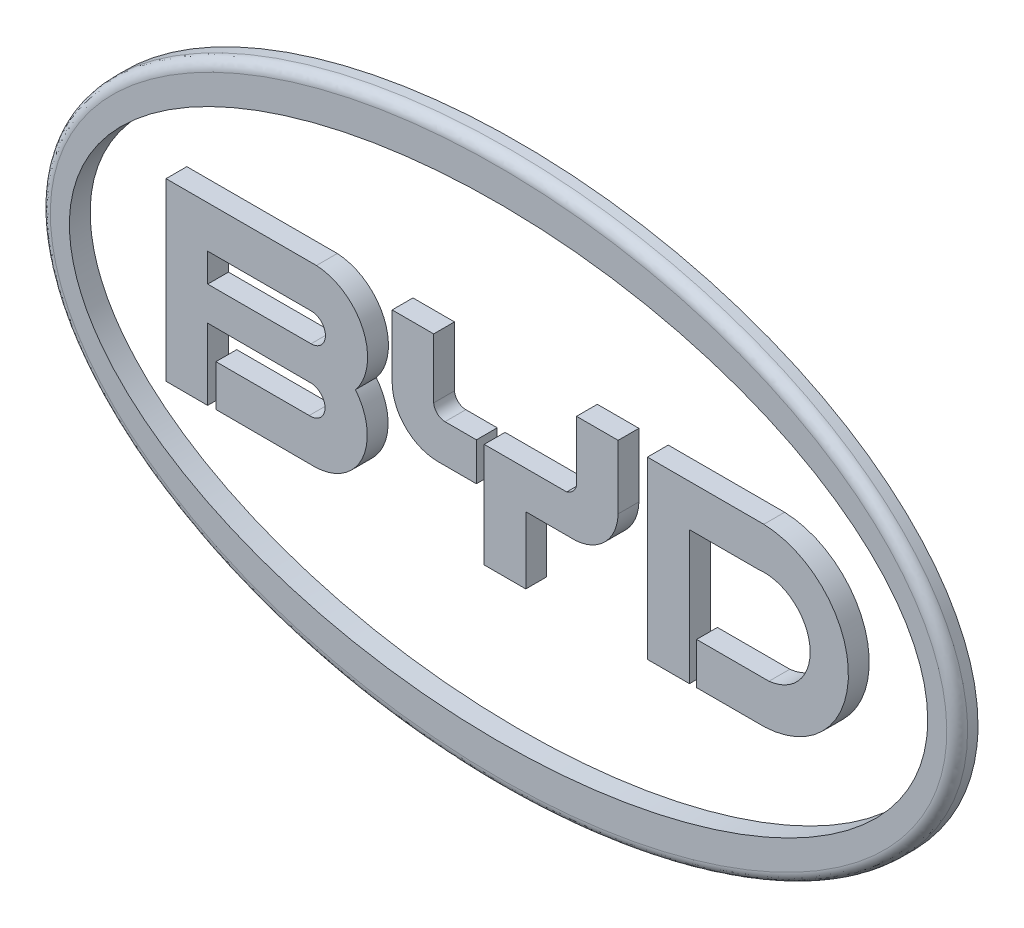
from build123d import *

# Parameters (mm, degrees)
SKETCH_3_RX       = 44.090053558
SKETCH_3_RY       = 26.443239621
SKETCH_3_RX_2     = 41.255952368
SKETCH_3_RY_2     = 22.400810242
EXTRUDE_1_DEPTH   = 2
EXTRUDE_1_2_DEPTH = 2
EXTRUDE_1_3_DEPTH = 2
EXTRUDE_1_4_DEPTH = 2
EXTRUDE_1_5_DEPTH = 2
FILLET_1_R        = 1


with BuildPart() as part:
    # 草图3 → 凸台-拉伸1 (new body)
    with BuildSketch(Plane.XY):
        with Locations(Location((117.824832916, 115.23790741), (0, 0, 180))):
            Ellipse(SKETCH_3_RX, SKETCH_3_RY)
        with Locations((117.824832916, 115.23790741)):
            Ellipse(SKETCH_3_RX_2, SKETCH_3_RY_2, mode=Mode.SUBTRACT)
    extrude(amount=EXTRUDE_1_DEPTH)

    # 圆角1
    fillet_1_edges = [part.edges().sort_by_distance(p)[0] for p in [
        (161.914770663, 115.298516103, 2),
    ]]
    fillet(fillet_1_edges, radius=FILLET_1_R)


with BuildPart() as body_2:
    # 草图3 → Extrude 1 2 (new body)
    with BuildSketch(Plane.XY):
        with BuildLine():
            Line((100.320487976, 123.701698303), (85.857902527, 123.701698303))
            Line((85.857902527, 123.701698303), (85.857902527, 106.831474304))
            Line((85.857902527, 106.831474304), (89.85785675, 106.821266174))
            Line((89.85785675, 106.821266174), (89.85785675, 113.6771698))
            Line((89.85785675, 113.6771698), (99.629045068, 113.652244725))
            ThreePointArc((99.629045068, 113.652244725), (99.745733087, 113.656821169), (99.86239624, 113.651649475))
            ThreePointArc((99.86239624, 113.651649475), (101.141097708, 112.257892609), (99.86239624, 110.864135742))
            ThreePointArc((99.86239624, 110.864135742), (99.742164596, 110.858959497), (99.621932952, 110.864135742))
            Line((99.621932952, 110.864135742), (90.656356812, 110.864135742))
            Line((90.656356812, 110.864135742), (90.656356812, 106.879867554))
            Line((90.656356812, 106.879867554), (99.860228116, 106.856387052))
            Line((99.860228116, 106.856387052), (100.208221436, 106.855499268))
            ThreePointArc((100.208221436, 106.855499268), (104.731739573, 109.852213429), (104.070821683, 115.23790741))
            ThreePointArc((104.070821683, 115.23790741), (104.793856796, 120.621074732), (100.320487976, 123.701698303))
        make_face()
        with BuildLine():
            Line((89.865707397, 116.923698425), (89.865707397, 119.666885376))
            Line((89.865707397, 119.666885376), (99.797425153, 119.666885376))
            Line((99.797425153, 119.666885376), (99.823417664, 119.666885376))
            ThreePointArc((99.823417664, 119.666885376), (101.182014946, 118.28271099), (99.798248291, 116.923698425))
            Line((99.798248291, 116.923698425), (89.865707397, 116.923698425))
        make_face(mode=Mode.SUBTRACT)
    extrude(amount=EXTRUDE_1_2_DEPTH)


with BuildPart() as body_3:
    # 草图3 → Extrude 1 3 (new body)
    with BuildSketch(Plane.XY):
        with BuildLine():
            ThreePointArc((111.588310242, 117.898681641), (111.937267918, 117.178522683), (112.678985596, 116.878097534))
            Line((112.678985596, 116.878097534), (115.696937561, 116.878097534))
            Line((115.696937561, 116.878097534), (115.696937561, 113.216255188))
            Line((115.696937561, 113.216255188), (112.02633667, 113.216255188))
            ThreePointArc((112.02633667, 113.216255188), (108.882327189, 114.5074245), (107.595947266, 117.653396606))
            Line((107.595947266, 117.653396606), (107.595947266, 123.64239502))
            Line((107.595947266, 123.64239502), (111.588310242, 123.64239502))
            Line((111.588310242, 123.64239502), (111.588310242, 117.898681641))
        make_face()
    extrude(amount=EXTRUDE_1_3_DEPTH)


with BuildPart() as body_4:
    # 草图3 → Extrude 1 4 (new body)
    with BuildSketch(Plane.XY):
        with BuildLine():
            Line((124.547664698, 113.264060974), (125.282608032, 113.264060974))
            ThreePointArc((125.282608032, 113.264060974), (128.113315049, 114.623573913), (129.320327759, 117.522590637))
            Line((129.320327759, 117.522590637), (129.320327759, 123.64755249))
            Line((129.320327759, 123.64755249), (125.319236755, 123.64755249))
            Line((125.319236755, 123.64755249), (125.319236755, 117.847755432))
            ThreePointArc((125.319236755, 117.847755432), (124.968269871, 117.246162802), (124.376983643, 116.878097534))
            Line((124.376983643, 116.878097534), (116.446258545, 116.873641968))
            Line((116.446258545, 116.873641968), (116.446258545, 106.834098816))
            Line((116.446258545, 106.834098816), (120.443962097, 106.834098816))
            Line((120.443962097, 106.834098816), (120.443962097, 113.264060974))
            Line((120.443962097, 113.264060974), (124.547664698, 113.264060974))
        make_face()
    extrude(amount=EXTRUDE_1_4_DEPTH)


with BuildPart() as body_5:
    # 草图3 → Extrude 1 5 (new body)
    with BuildSketch(Plane.XY):
        with BuildLine():
            ThreePointArc((143.89906311, 119.63936615), (147.779438013, 115.207061658), (143.822433472, 110.843032837))
            Line((143.822433472, 110.843032837), (136.862030029, 110.843032837))
            Line((136.862030029, 110.843032837), (136.862030029, 106.825332642))
            Line((136.862030029, 106.825332642), (143.409423828, 106.825332642))
            ThreePointArc((143.409423828, 106.825332642), (151.457049674, 115.283053778), (143.326080322, 123.660682678))
            Line((143.326080322, 123.660682678), (132.137237549, 123.660682678))
            Line((132.137237549, 123.660682678), (132.137237549, 106.814918518))
            Line((132.137237549, 106.814918518), (136.179397583, 106.814918518))
            Line((136.179397583, 106.814918518), (136.179397583, 119.63936615))
            Line((136.179397583, 119.63936615), (142.804812511, 119.63936615))
            ThreePointArc((142.804812511, 119.63936615), (143.351937811, 119.673300221), (143.89906311, 119.63936615))
        make_face()
    extrude(amount=EXTRUDE_1_5_DEPTH)


solid = Compound([part.part, body_2.part, body_3.part, body_4.part, body_5.part])
